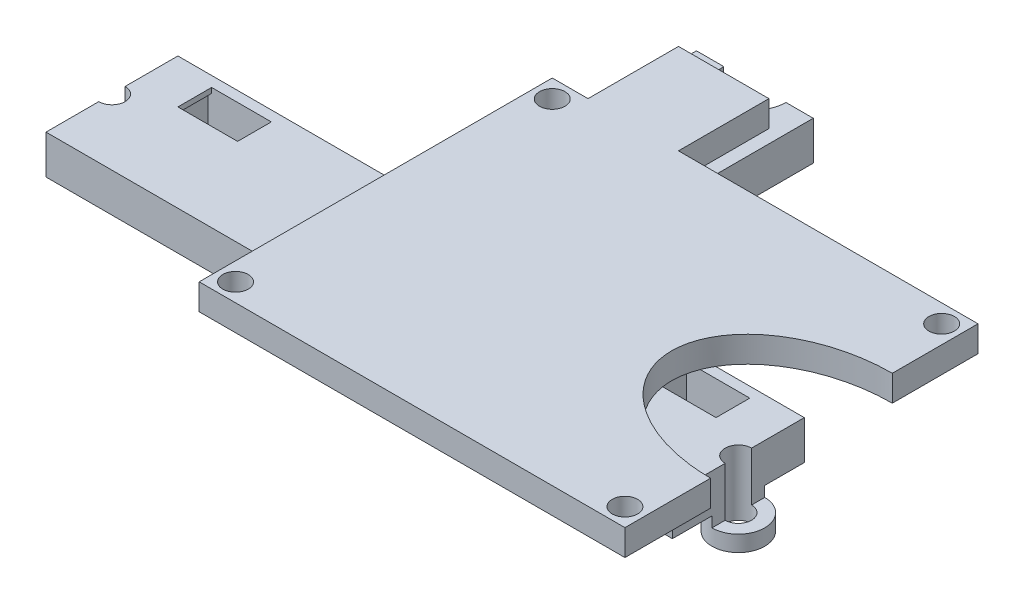
from build123d import *

# Parameters (mm, degrees)
BOSS_EXTRUDE1_DEPTH = 7.5
BOSS_EXTRUDE2_DEPTH = 7.5
SKETCH6_W           = 82
SKETCH6_H           = 68
SKETCH6_R           = 2.45
BOSS_EXTRUDE4_DEPTH = 5
SKETCH7_W           = 17.42019984
SKETCH7_H           = 17.42019984
BOSS_EXTRUDE5_DEPTH = 5
BOSS_EXTRUDE6_START = -5.08
BOSS_EXTRUDE6_DEPTH = 5.08
CUT_EXTRUDE1_START  = -2
CUT_EXTRUDE1_DEPTH  = 2
SKETCH6_3_R         = 2.45
BOSS_EXTRUDE7_DEPTH = 1
SKETCH8_RX          = 25
SKETCH8_RY          = 17.5
CUT_EXTRUDE4_DEPTH  = 5
CUT_EXTRUDE5_START  = -2
SKETCH9_W           = 0.7
SKETCH9_H           = 6.5
SKETCH9_W_2         = 5.75
SKETCH9_H_2         = 1
CUT_EXTRUDE5_DEPTH  = 6.5


with BuildPart() as part:
    # Sketch3 → Boss-Extrude1 (new body)
    with BuildSketch(Plane(origin=(0, 0, 0), x_dir=(1, 0, 0), z_dir=(0, 1, 0))):
        with BuildLine():
            Line((-60.325, -12.7), (60.325, -12.7))
            Line((60.325, -12.7), (60.325, -2.54))
            ThreePointArc((60.325, -2.54), (57.785, 0), (60.325, 2.54))
            Line((60.325, 2.54), (60.325, 12.7))
            Line((60.325, 12.7), (-60.325, 12.7))
            Line((-60.325, 12.7), (-60.325, 2.54))
            ThreePointArc((-60.325, 2.54), (-57.785, 0), (-60.325, -2.54))
            Line((-60.325, -2.54), (-60.325, -12.7))
        make_face()
    extrude(amount=BOSS_EXTRUDE1_DEPTH)

    # Sketch5 → Boss-Extrude2 (add)
    with BuildSketch(Plane(origin=(0, 7.5, 0), x_dir=(1, 0, 0), z_dir=(0, 1, 0))):
        with BuildLine():
            Line((-11.25, 63.5), (-11.25, 12.7))
            Line((-11.25, 12.7), (11.25, 12.7))
            Line((11.25, 12.7), (11.25, 63.5))
            Line((11.25, 63.5), (6, 63.5))
            ThreePointArc((6, 63.5), (0, 57.5), (-6, 63.5))
            Line((-6, 63.5), (-11.25, 63.5))
        make_face()
    extrude(amount=-BOSS_EXTRUDE2_DEPTH)

    # Sketch6 → Boss-Extrude4 (add)
    with BuildSketch(Plane(origin=(0, 7.5, 0), x_dir=(1, 0, 0), z_dir=(0, 1, 0))):
        with Locations((25.4, 6.07980016)):
            Rectangle(SKETCH6_W, SKETCH6_H)
        with Locations(Location((-12.1, -24.42019984, 0), (0, 0, 270))):
            Circle(SKETCH6_R, mode=Mode.SUBTRACT)
        with Locations(Location((-12.1, 36.57980016, 0), (0, 0, 90))):
            Circle(SKETCH6_R, mode=Mode.SUBTRACT)
        with Locations(Location((62.9, 36.57980016, 0), (0, 0, 270))):
            Circle(SKETCH6_R, mode=Mode.SUBTRACT)
        with Locations(Location((62.9, -24.42019984, 0), (0, 0, 90))):
            Circle(SKETCH6_R, mode=Mode.SUBTRACT)
    extrude(amount=BOSS_EXTRUDE4_DEPTH)

    # Sketch7 → Boss-Extrude5 (add)
    with BuildSketch(Plane(origin=(0, 7.5, 0), x_dir=(1, 0, 0), z_dir=(0, 1, 0))):
        with Locations((0, 48.78990008)):
            Rectangle(SKETCH7_W, SKETCH7_H)
    extrude(amount=BOSS_EXTRUDE5_DEPTH)

    # Sketch3<3> → Boss-Extrude6 (add)
    with BuildSketch(Plane(origin=(0, 0, 0), x_dir=(1, 0, 0), z_dir=(0, 1, 0)).offset(BOSS_EXTRUDE6_START)):
        with BuildLine():
            ThreePointArc((-60.325, 5.08), (-65.405, 0), (-60.325, -5.08))
            Line((-60.325, -5.08), (-60.325, -2.54))
            ThreePointArc((-60.325, -2.54), (-62.865, 0), (-60.325, 2.54))
            Line((-60.325, 2.54), (-60.325, 5.08))
        make_face()
        with BuildLine():
            Line((-60.325, -2.54), (-60.325, -5.08))
            ThreePointArc((-60.325, -5.08), (-56.732897552, -3.592102448), (-55.245, 0))
            ThreePointArc((-55.245, 0), (-56.732897552, 3.592102448), (-60.325, 5.08))
            Line((-60.325, 5.08), (-60.325, 2.54))
            ThreePointArc((-60.325, 2.54), (-58.528948776, 1.796051224), (-57.785, 0))
            ThreePointArc((-57.785, 0), (-58.528948776, -1.796051224), (-60.325, -2.54))
        make_face()
        with BuildLine():
            ThreePointArc((60.325, 5.08), (55.245, 0), (60.325, -5.08))
            Line((60.325, -5.08), (60.325, -2.54))
            ThreePointArc((60.325, -2.54), (57.785, 0), (60.325, 2.54))
            Line((60.325, 2.54), (60.325, 5.08))
        make_face()
        with BuildLine():
            Line((60.325, -2.54), (60.325, -5.08))
            ThreePointArc((60.325, -5.08), (63.917102448, -3.592102448), (65.405, 0))
            ThreePointArc((65.405, 0), (63.917102448, 3.592102448), (60.325, 5.08))
            Line((60.325, 5.08), (60.325, 2.54))
            ThreePointArc((60.325, 2.54), (62.121051224, 1.796051224), (62.865, 0))
            ThreePointArc((62.865, 0), (62.121051224, -1.796051224), (60.325, -2.54))
        make_face()
    extrude(amount=BOSS_EXTRUDE6_DEPTH)

    # Sketch3<4> → Cut-Extrude1 (cut)
    with BuildSketch(Plane(origin=(0, 0, 0), x_dir=(1, 0, 0), z_dir=(0, 1, 0)).offset(CUT_EXTRUDE1_START)):
        with BuildLine():
            ThreePointArc((-60.325, 5.08), (-65.405, 0), (-60.325, -5.08))
            Line((-60.325, -5.08), (-60.325, -2.54))
            ThreePointArc((-60.325, -2.54), (-62.865, 0), (-60.325, 2.54))
            Line((-60.325, 2.54), (-60.325, 5.08))
        make_face()
    cut_extrude1 = extrude(amount=CUT_EXTRUDE1_DEPTH, mode=Mode.SUBTRACT)

    # Mirror2: Cut-Extrude1 across plane
    add(cut_extrude1.mirror(Plane(origin=(0, 0, 0), x_dir=(0, 0, 1), z_dir=(1, 0, 0))), mode=Mode.SUBTRACT)

    # Sketch6<3> → Boss-Extrude7 (add)
    with BuildSketch(Plane(origin=(0, 7.5, 0), x_dir=(1, 0, 0), z_dir=(0, 1, 0))):
        with Locations(Location((-12.1, -24.42019984, 0), (0, 0, 270))):
            Circle(SKETCH6_3_R)
        with BuildLine():
            ThreePointArc((-9.65, 36.57980016), (-10.089403074, 37.97980016), (-11.25, 38.877625219))
            Line((-11.25, 38.877625219), (-11.25, 34.281975101))
            ThreePointArc((-11.25, 34.281975101), (-10.089403074, 35.17980016), (-9.65, 36.57980016))
        make_face()
        with BuildLine():
            Line((-11.25, 34.281975101), (-11.25, 38.877625219))
            ThreePointArc((-11.25, 38.877625219), (-14.55, 36.57980016), (-11.25, 34.281975101))
        make_face()
        with Locations(Location((62.9, 36.57980016, 0), (0, 0, 270))):
            Circle(SKETCH6_3_R)
        with Locations(Location((62.9, -24.42019984, 0), (0, 0, 90))):
            Circle(SKETCH6_3_R)
    extrude(amount=BOSS_EXTRUDE7_DEPTH)

    # Sketch8 → Cut-Extrude4 (cut)
    with BuildSketch(Plane(origin=(0, 12.5, 0), x_dir=(1, 0, 0), z_dir=(0, 1, 0))):
        with Locations(Location((66.4, 6.07980016), (0, 0, -180))):
            Ellipse(SKETCH8_RX, SKETCH8_RY)
    extrude(amount=-CUT_EXTRUDE4_DEPTH, mode=Mode.SUBTRACT)

    # Sketch9 → Cut-Extrude5 (cut)
    with BuildSketch(Plane(origin=(0, 0, -12.7), x_dir=(-1, 0, 0), z_dir=(0, 0, -1)).offset(CUT_EXTRUDE5_START)):
        with Locations((39.975, 3.25)):
            Rectangle(SKETCH9_W, SKETCH9_H)
        Polygon((51.825, 0), (51.825, 6.5), (46.075, 6.5), (40.325, 6.5), (40.325, 0), align=None)
        with Locations((52.175, 3.25)):
            Rectangle(SKETCH9_W, SKETCH9_H)
        with Locations((48.95, 7)):
            Rectangle(SKETCH9_W_2, SKETCH9_H_2)
        with Locations((43.2, 7)):
            Rectangle(SKETCH9_W_2, SKETCH9_H_2)
    cut_extrude5 = extrude(amount=-CUT_EXTRUDE5_DEPTH, mode=Mode.SUBTRACT)

    # Mirror3: Cut-Extrude5 across plane
    add(cut_extrude5.mirror(Plane(origin=(0, 0, 0), x_dir=(0, 0, 1), z_dir=(1, 0, 0))), mode=Mode.SUBTRACT)


solid = part.part
